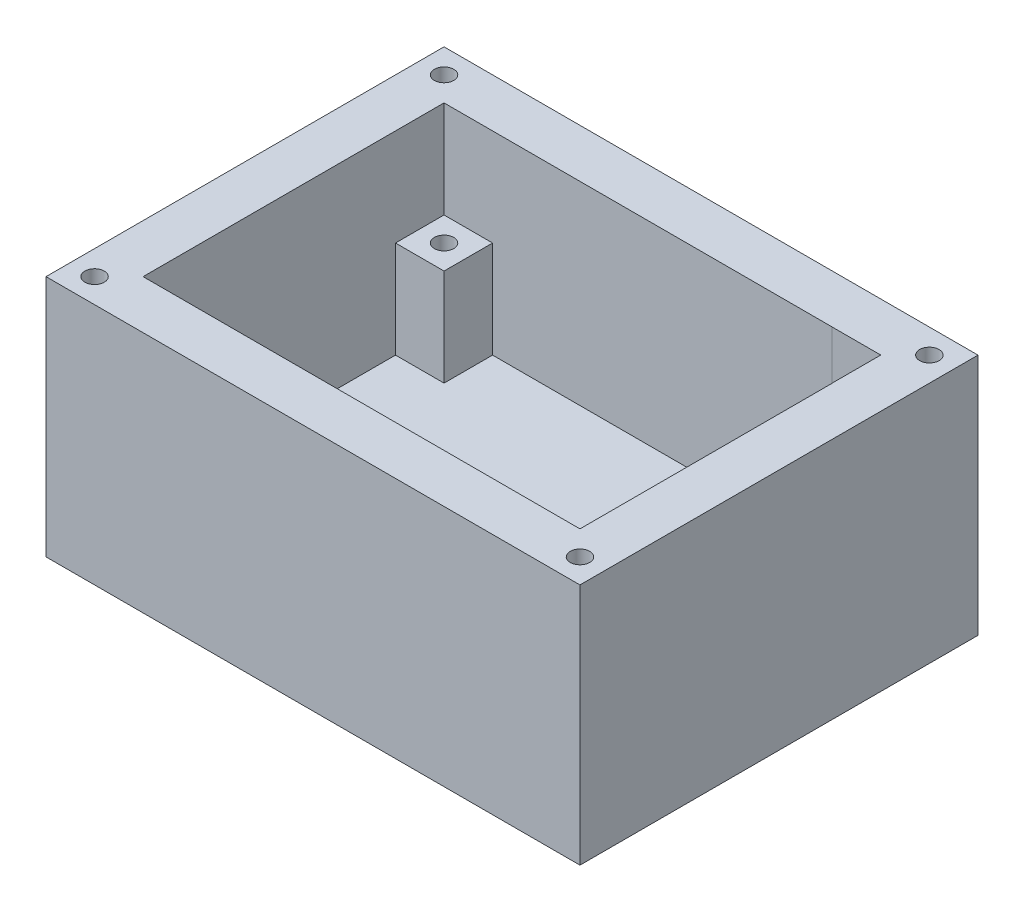
from build123d import *

# Parameters (mm, degrees)
SKETCH2_W            = 55
SKETCH2_H            = 5
SKETCH2_W_2          = 5
BOSS_EXTRUDE3_DEPTH  = 20
SKETCH3_W            = 5
SKETCH3_H            = 5
CUT_EXTRUDE1_DEPTH   = 10
SKETCH5_W            = 5
SKETCH5_H            = 5
CUT_EXTRUDE2_DEPTH   = 10
SKETCH6_W            = 5
SKETCH6_H            = 5
CUT_EXTRUDE3_DEPTH   = 10
SKETCH7_R            = 1
CUT_EXTRUDE5_DEPTH   = 10
SKETCH8_R            = 1
CUT_EXTRUDE6_DEPTH   = 10
SKETCH9_R            = 1
CUT_EXTRUDE7_DEPTH   = 10
SKETCH10_R           = 1
CUT_EXTRUDE8_DEPTH   = 10
SKETCH11_W           = 55
SKETCH11_H           = 41
BOSS_EXTRUDE10_DEPTH = 5
SKETCH12_R           = 1
CUT_EXTRUDE9_DEPTH   = 10
SKETCH13_R           = 1
CUT_EXTRUDE10_DEPTH  = 10
SKETCH14_R           = 1
CUT_EXTRUDE11_DEPTH  = 10
SKETCH15_R           = 1
CUT_EXTRUDE12_DEPTH  = 10


with BuildPart() as part:
    # Sketch2 → Boss-Extrude3 (new body)
    with BuildSketch(Plane(origin=(0, 0, 0), x_dir=(1, 0, 0), z_dir=(0, 1, 0))):
        with Locations((-27.5, 2.5)):
            Rectangle(SKETCH2_W, SKETCH2_H)
        Polygon((-5, 5), (0, 5), (0, 41), (-5, 41), (-5, 36), (-5, 30.997910325), (-5, 10), align=None)
        Polygon((-5, 36), (-5, 41), (-50, 41), (-50, 36), (-45, 36), (-10.013652048, 36), (-9.330274009, 36), align=None)
        Polygon((-55, 41), (-55, 5), (-50, 5), (-50, 10), (-50, 31), (-50, 36), (-50, 41), align=None)
        with Locations((-47.5, 33.5)):
            Rectangle(SKETCH2_W_2, SKETCH2_H)
        with Locations((-47.5, 7.5)):
            Rectangle(SKETCH2_W_2, SKETCH2_H)
        Polygon((-10.013652048, 30.997910325), (-5, 30.997910325), (-5, 36), (-9.330274009, 36), (-10.013652048, 36), align=None)
        with Locations((-7.5, 7.5)):
            Rectangle(SKETCH2_W_2, SKETCH2_H)
    extrude(amount=BOSS_EXTRUDE3_DEPTH)

    # Sketch3 → Cut-Extrude1 (cut)
    with BuildSketch(Plane(origin=(0, 20, 0), x_dir=(1, 0, 0), z_dir=(0, 1, 0))):
        with Locations((-7.513652048, 33.497910325)):
            Rectangle(SKETCH3_W, SKETCH3_H)
    extrude(amount=-CUT_EXTRUDE1_DEPTH, mode=Mode.SUBTRACT)

    # Sketch5 → Cut-Extrude2 (cut)
    with BuildSketch(Plane(origin=(0, 20, 0), x_dir=(1, 0, 0), z_dir=(0, 1, 0))):
        with Locations((-47.5, 33.5)):
            Rectangle(SKETCH5_W, SKETCH5_H)
    extrude(amount=-CUT_EXTRUDE2_DEPTH, mode=Mode.SUBTRACT)

    # Sketch6 → Cut-Extrude3 (cut)
    with BuildSketch(Plane(origin=(0, 20, 0), x_dir=(1, 0, 0), z_dir=(0, 1, 0))):
        with Locations((-47.5, 7.5)):
            Rectangle(SKETCH6_W, SKETCH6_H)
        with Locations((-7.5, 7.5)):
            Rectangle(SKETCH6_W, SKETCH6_H)
    extrude(amount=-CUT_EXTRUDE3_DEPTH, mode=Mode.SUBTRACT)

    # Sketch7 → Cut-Extrude5 (cut)
    with BuildSketch(Plane(origin=(0, 10, 0), x_dir=(1, 0, 0), z_dir=(0, 1, 0))):
        with Locations(Location((-47.5, 33.5, 0), (0, 0, 270))):
            Circle(SKETCH7_R)
    extrude(amount=-CUT_EXTRUDE5_DEPTH, mode=Mode.SUBTRACT)

    # Sketch8 → Cut-Extrude6 (cut)
    with BuildSketch(Plane(origin=(0, 10, 0), x_dir=(1, 0, 0), z_dir=(0, 1, 0))):
        with Locations(Location((-7.513652048, 33.497910325, 0), (0, 0, 270))):
            Circle(SKETCH8_R)
    extrude(amount=-CUT_EXTRUDE6_DEPTH, mode=Mode.SUBTRACT)

    # Sketch9 → Cut-Extrude7 (cut)
    with BuildSketch(Plane(origin=(0, 10, 0), x_dir=(1, 0, 0), z_dir=(0, 1, 0))):
        with Locations(Location((-47.5, 7.5, 0), (0, 0, 270))):
            Circle(SKETCH9_R)
    extrude(amount=-CUT_EXTRUDE7_DEPTH, mode=Mode.SUBTRACT)

    # Sketch10 → Cut-Extrude8 (cut)
    with BuildSketch(Plane(origin=(0, 10, 0), x_dir=(1, 0, 0), z_dir=(0, 1, 0))):
        with Locations(Location((-7.5, 7.5, 0), (0, 0, 270))):
            Circle(SKETCH10_R)
    extrude(amount=-CUT_EXTRUDE8_DEPTH, mode=Mode.SUBTRACT)

    # Sketch11 → Boss-Extrude10 (add)
    with BuildSketch(Plane(origin=(0, 0, 0), x_dir=(-1, 0, 0), z_dir=(0, -1, 0))):
        with Locations((27.5, 20.5)):
            Rectangle(SKETCH11_W, SKETCH11_H)
    extrude(amount=BOSS_EXTRUDE10_DEPTH)

    # Sketch12 → Cut-Extrude9 (cut)
    with BuildSketch(Plane(origin=(0, 20, 0), x_dir=(1, 0, 0), z_dir=(0, 1, 0))):
        with Locations(Location((-52.5, 38.5, 0), (0, 0, 270))):
            Circle(SKETCH12_R)
    extrude(amount=-CUT_EXTRUDE9_DEPTH, mode=Mode.SUBTRACT)

    # Sketch13 → Cut-Extrude10 (cut)
    with BuildSketch(Plane(origin=(0, 20, 0), x_dir=(1, 0, 0), z_dir=(0, 1, 0))):
        with Locations(Location((-2.506826024, 38.498955163, 0), (0, 0, 270))):
            Circle(SKETCH13_R)
    extrude(amount=-CUT_EXTRUDE10_DEPTH, mode=Mode.SUBTRACT)

    # Sketch14 → Cut-Extrude11 (cut)
    with BuildSketch(Plane(origin=(0, 20, 0), x_dir=(1, 0, 0), z_dir=(0, 1, 0))):
        with Locations(Location((-52.5, 2.5, 0), (0, 0, 270))):
            Circle(SKETCH14_R)
    extrude(amount=-CUT_EXTRUDE11_DEPTH, mode=Mode.SUBTRACT)

    # Sketch15 → Cut-Extrude12 (cut)
    with BuildSketch(Plane(origin=(0, 20, 0), x_dir=(1, 0, 0), z_dir=(0, 1, 0))):
        with Locations(Location((-2.5, 2.5, 0), (0, 0, 270))):
            Circle(SKETCH15_R)
    extrude(amount=-CUT_EXTRUDE12_DEPTH, mode=Mode.SUBTRACT)


solid = part.part
